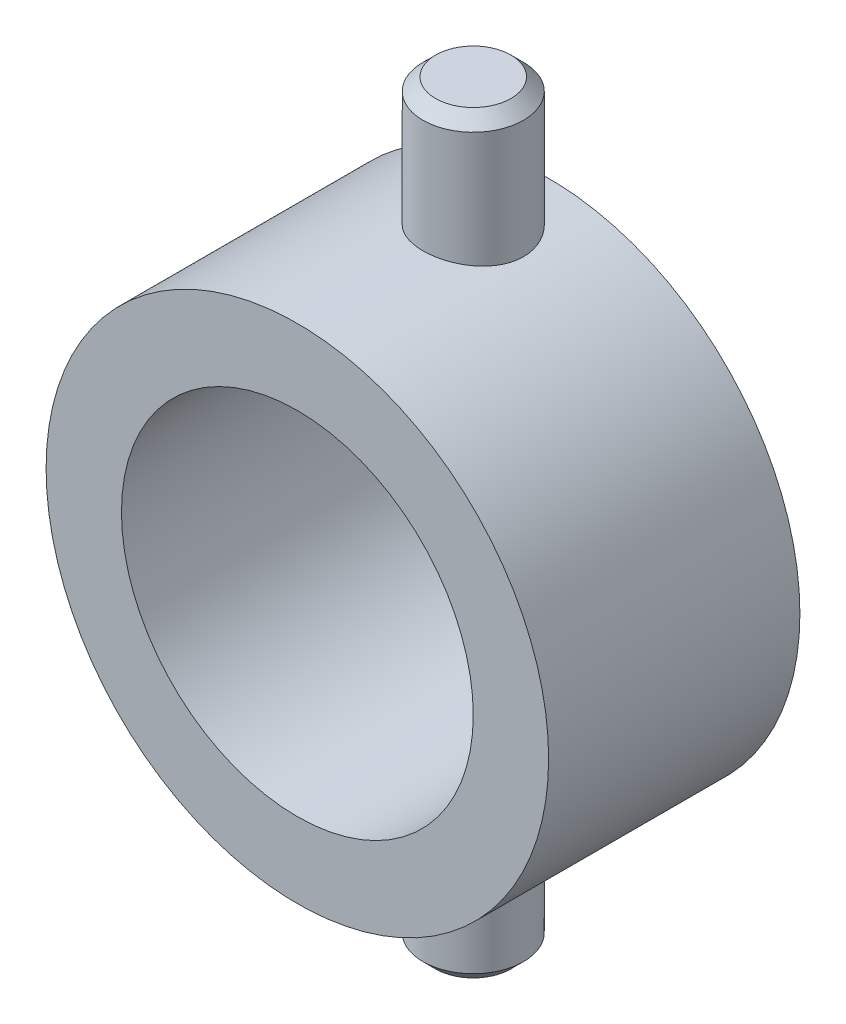
from build123d import *

# Parameters (mm, degrees)
SKETCH1_R                = 10
BOSS_EXTRUDE1_DEPTH      = 10
SKETCH2_R                = 7
CUT_EXTRUDE1_DEPTH       = 18.320508076
BOSS_EXTRUDE3_REACH      = 30.723
BOSS_EXTRUDE3_END_RADIUS = 10
SKETCH4_R                = 2
CHAMFER2_SIZE            = 0.5


with BuildPart() as part:
    # Sketch1 → Boss-Extrude1 (new body)
    with BuildSketch(Plane.XY):
        Circle(SKETCH1_R)
    extrude(amount=BOSS_EXTRUDE1_DEPTH)

    # Sketch2 → Cut-Extrude1 (cut, through all)
    with BuildSketch(Plane(origin=(0, 0, 0), x_dir=(-1, 0, 0), z_dir=(0, 0, -1))):
        Circle(SKETCH2_R)
    extrude(amount=-CUT_EXTRUDE1_DEPTH, mode=Mode.SUBTRACT)

    # Boss-Extrude3: up to this cylinder (the profile starts outside it)
    boss_extrude3_end = Plane(origin=(0, 0, 3), z_dir=(0, 0, -1)) * Cylinder(BOSS_EXTRUDE3_END_RADIUS, 82.446, mode=Mode.PRIVATE)
    # Sketch4 → Boss-Extrude3 (add, up to the surface)
    with BuildSketch(Plane(origin=(0, 15, 0), x_dir=(1, 0, 0), z_dir=(0, 1, 0)), mode=Mode.PRIVATE) as boss_extrude3_sk1:
        with Locations(Location((0, -3, 0), (0, 0, 270))):
            Circle(SKETCH4_R)
    boss_extrude3_tool1 = extrude(boss_extrude3_sk1.sketch, amount=-BOSS_EXTRUDE3_REACH, mode=Mode.PRIVATE) - boss_extrude3_end
    boss_extrude3 = boss_extrude3_tool1.solids().sort_by_distance((0, 15, 3))[0]
    add(boss_extrude3)

    # Mirror2: Boss-Extrude3 across plane
    add(boss_extrude3.mirror(Plane.ZX))

    # Chamfer2
    chamfer2_edges = [part.edges().sort_by_distance(p)[0] for p in [
        (0, 15, 1),
        (0, -15, 1),
    ]]
    chamfer(chamfer2_edges, length=CHAMFER2_SIZE)


solid = part.part
